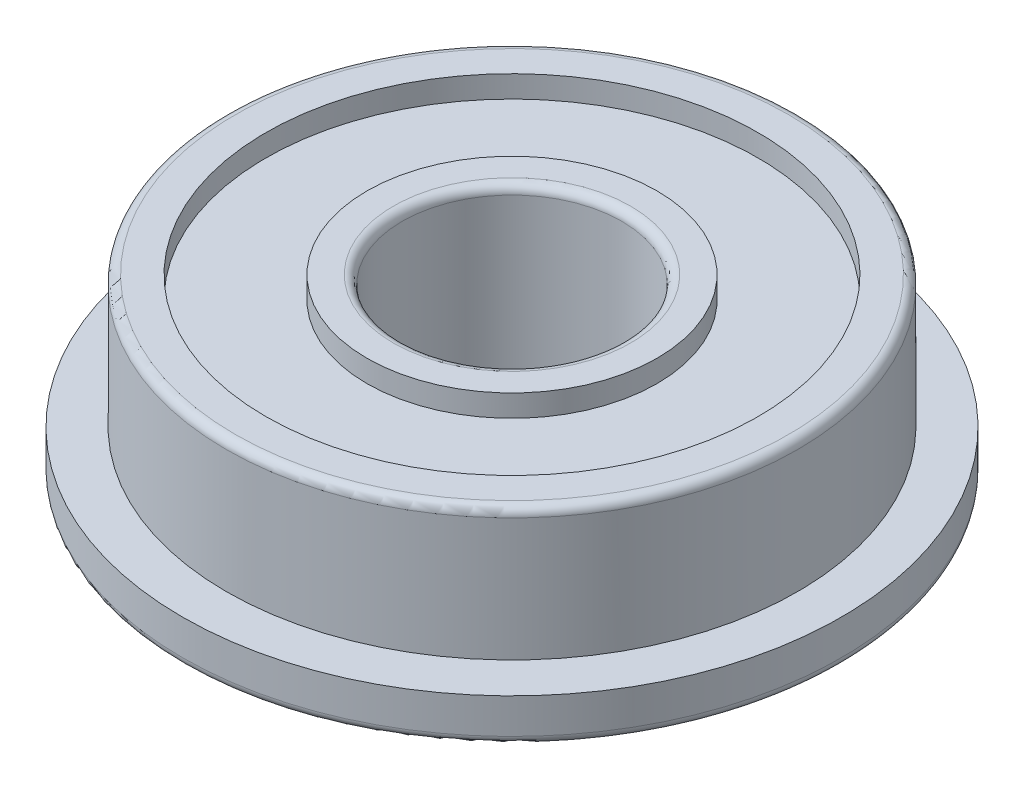
from build123d import *

# Parameters (mm, degrees)
FILLET_1_R = 0.2


with BuildPart() as part:
    # 草图1 → 旋转1 (revolve)
    with BuildSketch(Plane.XY, mode=Mode.PRIVATE) as revolve_1_sk:
        Polygon((2.5, 4), (2.5, 0), (3.3, 0), (3.3, 0.5), (5.6, 0.5), (5.6, 0), (7.5, 0), (7.5, 1), (6.5, 1), (6.5, 4), (5.6, 4), (5.6, 3.5), (3.3, 3.5), (3.3, 4), align=None)
    revolve(revolve_1_sk.sketch.rotate(Axis((0, 5.412170411, 0), (0, -1, 0)), 90), axis=Axis((0, 5.412170411, 0), (0, -1, 0)))

    # 圆角1
    fillet_1_edges = [part.edges().sort_by_distance(p)[0] for p in [
        (0, 0, -2.5),
        (0, 4, -2.5),
        (0, 4, -6.5),
        (0, 0, -7.5),
    ]]
    fillet(fillet_1_edges, radius=FILLET_1_R)


solid = part.part
